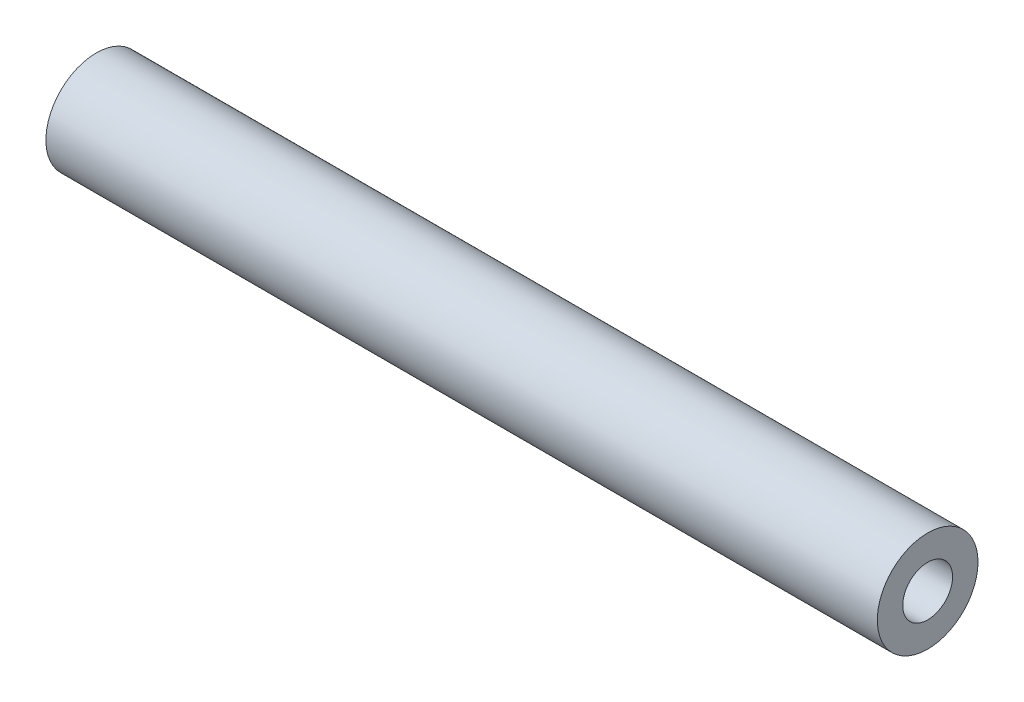
from build123d import *

# Parameters (mm, degrees)
SKETCH2_R           = 30.275
SKETCH2_R_2         = 15
BOSS_EXTRUDE1_DEPTH = 500


with BuildPart() as part:
    # Sketch2 → Boss-Extrude1 (new body)
    with BuildSketch(Plane(origin=(0, 0, 0), x_dir=(0, 0, -1), z_dir=(1, 0, 0))):
        with Locations((-3.397466775, -0.647349453)):
            Circle(SKETCH2_R)
        with Locations((-3.397466775, -0.647349453)):
            Circle(SKETCH2_R_2, mode=Mode.SUBTRACT)
    extrude(amount=BOSS_EXTRUDE1_DEPTH)


solid = part.part
